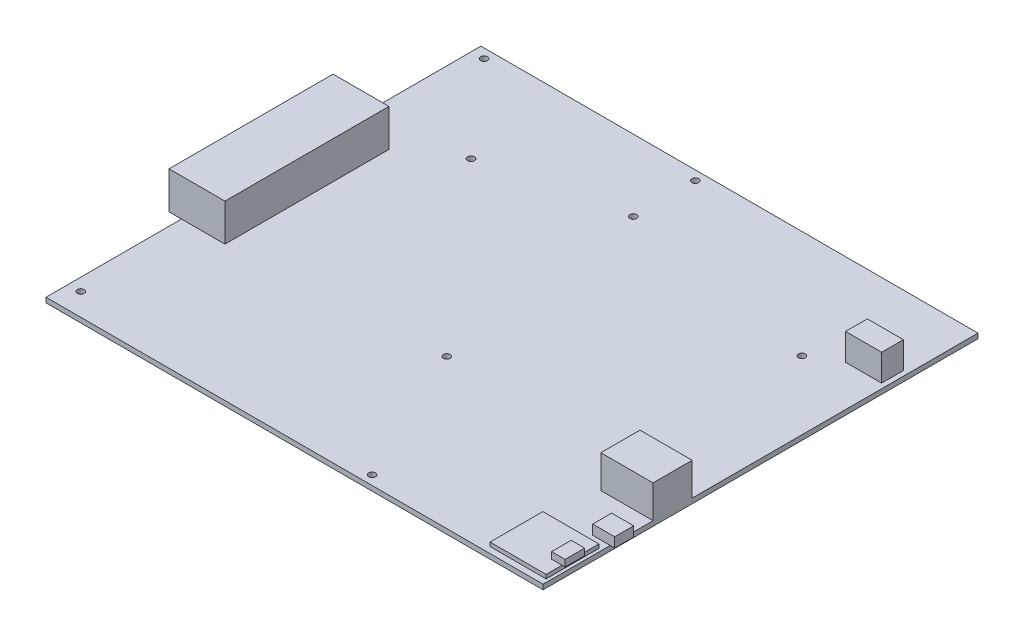
from build123d import *

# Parameters (mm, degrees)
SKETCH1_W               = 203.2
SKETCH1_H               = 177.8
BOSS_EXTRUDE1_DEPTH     = 2
SKETCH3_W               = 21.35
SKETCH3_H               = 16
BOSS_EXTRUDE2_DEPTH     = 13.4
CUT_EXTRUDE1_DEPTH      = 136.666244881
CUT_EXTRUDE1_DEPTH_BACK = 136.666244881
SKETCH2_R               = 1.397
SKETCH4_W               = 22.86
SKETCH4_H               = 67.056
BOSS_EXTRUDE3_DEPTH     = 15.24
SKETCH5_W               = 14.75
SKETCH5_H               = 8.9
BOSS_EXTRUDE4_DEPTH     = 10.922
SKETCH7_W               = 9
SKETCH7_H               = 7.75
BOSS_EXTRUDE5_DEPTH     = 4
SKETCH8_W               = 22.9
SKETCH8_H               = 21.57
BOSS_EXTRUDE6_DEPTH     = 1.6
SKETCH9_W               = 5.5
SKETCH9_H               = 8
BOSS_EXTRUDE7_DEPTH     = 2.7


with BuildPart() as part:
    # Sketch1 → Boss-Extrude1 (new body)
    with BuildSketch(Plane(origin=(0, 0, 0), x_dir=(1, 0, 0), z_dir=(0, 1, 0))):
        Rectangle(SKETCH1_W, SKETCH1_H)
    extrude(amount=BOSS_EXTRUDE1_DEPTH)

    # Sketch3 → Boss-Extrude2 (add)
    with BuildSketch(Plane(origin=(0, 2, 0), x_dir=(1, 0, 0), z_dir=(0, 1, 0))):
        with Locations((90.925, -35.94)):
            Rectangle(SKETCH3_W, SKETCH3_H)
    extrude(amount=BOSS_EXTRUDE2_DEPTH)

    # Sketch2 → Cut-Extrude1 (cut, two sides: drawn at the far end of the back side and taken through both)
    with BuildSketch(Plane(origin=(0, 2, 0), x_dir=(1, 0, 0), z_dir=(0, 1, 0)).offset(-CUT_EXTRUDE1_DEPTH_BACK)):
        with Locations(Location((-96.52, 85.09, 0), (0, 0, 270))):
            Circle(SKETCH2_R)
        with Locations(Location((-10.16, 85.09, 0), (0, 0, 270))):
            Circle(SKETCH2_R)
        with Locations(Location((-10.16, 59.69, 0), (0, 0, 270))):
            Circle(SKETCH2_R)
        with Locations(Location((73.66, 44.831, 0), (0, 0, 270))):
            Circle(SKETCH2_R)
        with Locations(Location((-63.754, 46.99, 0), (0, 0, 270))):
            Circle(SKETCH2_R)
        with Locations(Location((1.27, -27.94, 0), (0, 0, 270))):
            Circle(SKETCH2_R)
        with Locations(Location((-96.52, -79.756, 0), (0, 0, 270))):
            Circle(SKETCH2_R)
        with Locations(Location((27.94, -85.09, 0), (0, 0, 270))):
            Circle(SKETCH2_R)
        with Locations(Location((-88.9, -30.48, 0), (0, 0, 270))):
            Circle(SKETCH2_R)
        with Locations(Location((-88.9, 30.48, 0), (0, 0, 270))):
            Circle(SKETCH2_R)
    extrude(amount=CUT_EXTRUDE1_DEPTH + CUT_EXTRUDE1_DEPTH_BACK, mode=Mode.SUBTRACT)

    # Sketch4 → Boss-Extrude3 (add)
    with BuildSketch(Plane(origin=(0, 2, 0), x_dir=(1, 0, 0), z_dir=(0, 1, 0))):
        with Locations((-95.25, 0)):
            Rectangle(SKETCH4_W, SKETCH4_H)
    extrude(amount=BOSS_EXTRUDE3_DEPTH)

    # Sketch5 → Boss-Extrude4 (add)
    with BuildSketch(Plane(origin=(0, 2, 0), x_dir=(1, 0, 0), z_dir=(0, 1, 0))):
        with Locations((92.225, 55.95)):
            Rectangle(SKETCH5_W, SKETCH5_H)
    extrude(amount=BOSS_EXTRUDE4_DEPTH)

    # Sketch7 → Boss-Extrude5 (add)
    with BuildSketch(Plane(origin=(0, 2, 0), x_dir=(1, 0, 0), z_dir=(0, 1, 0))):
        with Locations((98.95, -57.575)):
            Rectangle(SKETCH7_W, SKETCH7_H)
    extrude(amount=BOSS_EXTRUDE5_DEPTH)

    # Sketch8 → Boss-Extrude6 (add)
    with BuildSketch(Plane(origin=(0, 2, 0), x_dir=(1, 0, 0), z_dir=(0, 1, 0))):
        with Locations((88.9, -75.615)):
            Rectangle(SKETCH8_W, SKETCH8_H)
    extrude(amount=BOSS_EXTRUDE6_DEPTH)

    # Sketch9 → Boss-Extrude7 (add)
    with BuildSketch(Plane(origin=(0, 3.6, 0), x_dir=(1, 0, 0), z_dir=(0, 1, 0))):
        with Locations((98.85, -75.9)):
            Rectangle(SKETCH9_W, SKETCH9_H)
    extrude(amount=BOSS_EXTRUDE7_DEPTH)


solid = part.part
